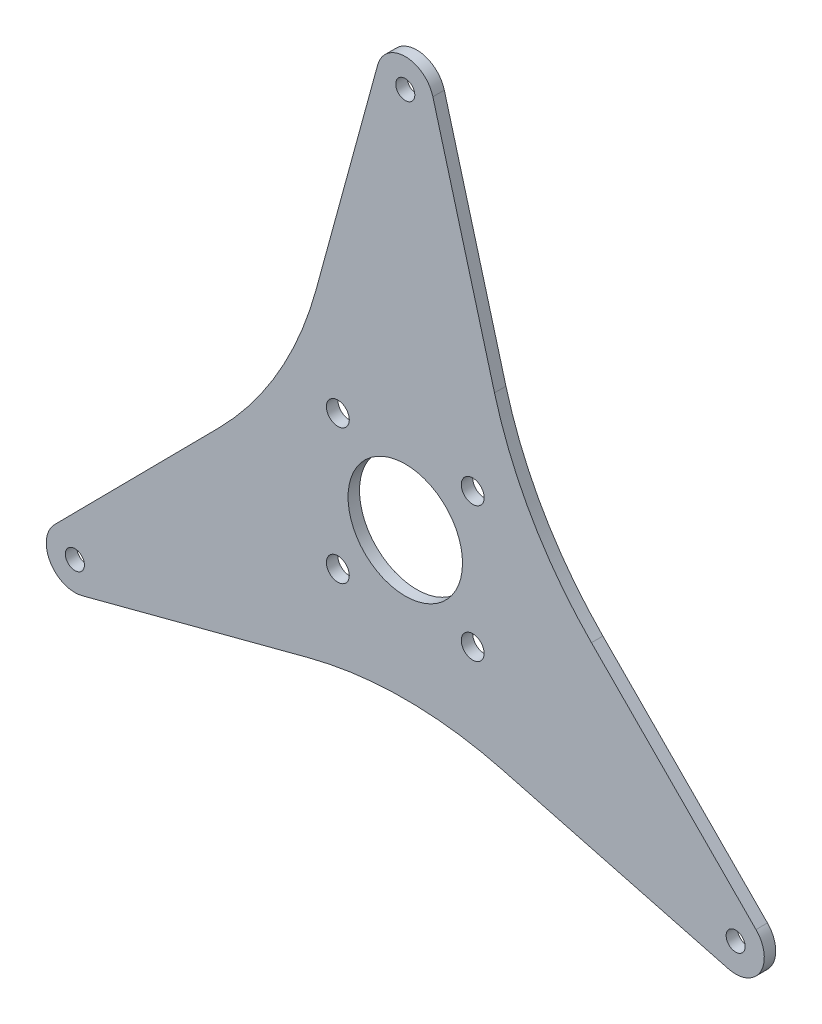
from build123d import *

# Parameters (mm, degrees)
SKETCH1_R           = 5
SKETCH1_R_2         = 6
SKETCH1_R_3         = 30
BOSS_EXTRUDE1_DEPTH = 6


with BuildPart() as part:
    # Sketch1 → Boss-Extrude1 (new body)
    with BuildSketch(Plane.XY):
        with BuildLine():
            Line((-183.863104209, -89.445070531), (-97.598804033, -2.338194347))
            ThreePointArc((-97.598804033, -2.338194347), (-66.500702639, 38.39419857), (-46.774466313, 85.692140845))
            Line((-46.774466313, 85.692140845), (-14.469848781, 203.952654329))
            ThreePointArc((-14.469848781, 203.952654329), (0, 215), (14.469848781, 203.952654329))
            Line((14.469848781, 203.952654329), (46.774466313, 85.692140845))
            ThreePointArc((46.774466313, 85.692140845), (66.500702639, 38.39419857), (97.598804033, -2.338194347))
            Line((97.598804033, -2.338194347), (183.863104209, -89.445070531))
            ThreePointArc((183.863104209, -89.445070531), (186.195461814, -107.5), (169.393255428, -114.507583798))
            Line((169.393255428, -114.507583798), (50.82433772, -83.353946498))
            ThreePointArc((50.82433772, -83.353946498), (0, -76.78839714), (-50.82433772, -83.353946498))
            Line((-50.82433772, -83.353946498), (-169.393255428, -114.507583798))
            ThreePointArc((-169.393255428, -114.507583798), (-186.195461814, -107.5), (-183.863104209, -89.445070531))
        make_face()
        with Locations((0, 200)):
            Circle(SKETCH1_R, mode=Mode.SUBTRACT)
        with Locations((173.205080757, -100)):
            Circle(SKETCH1_R, mode=Mode.SUBTRACT)
        with Locations((-173.205080757, -100)):
            Circle(SKETCH1_R, mode=Mode.SUBTRACT)
        with Locations((-35.355339059, 35.355339059)):
            Circle(SKETCH1_R_2, mode=Mode.SUBTRACT)
        with Locations((35.355339059, 35.355339059)):
            Circle(SKETCH1_R_2, mode=Mode.SUBTRACT)
        with Locations((35.355339059, -35.355339059)):
            Circle(SKETCH1_R_2, mode=Mode.SUBTRACT)
        with Locations((-35.355339059, -35.355339059)):
            Circle(SKETCH1_R_2, mode=Mode.SUBTRACT)
        Circle(SKETCH1_R_3, mode=Mode.SUBTRACT)
    extrude(amount=BOSS_EXTRUDE1_DEPTH)


solid = part.part
